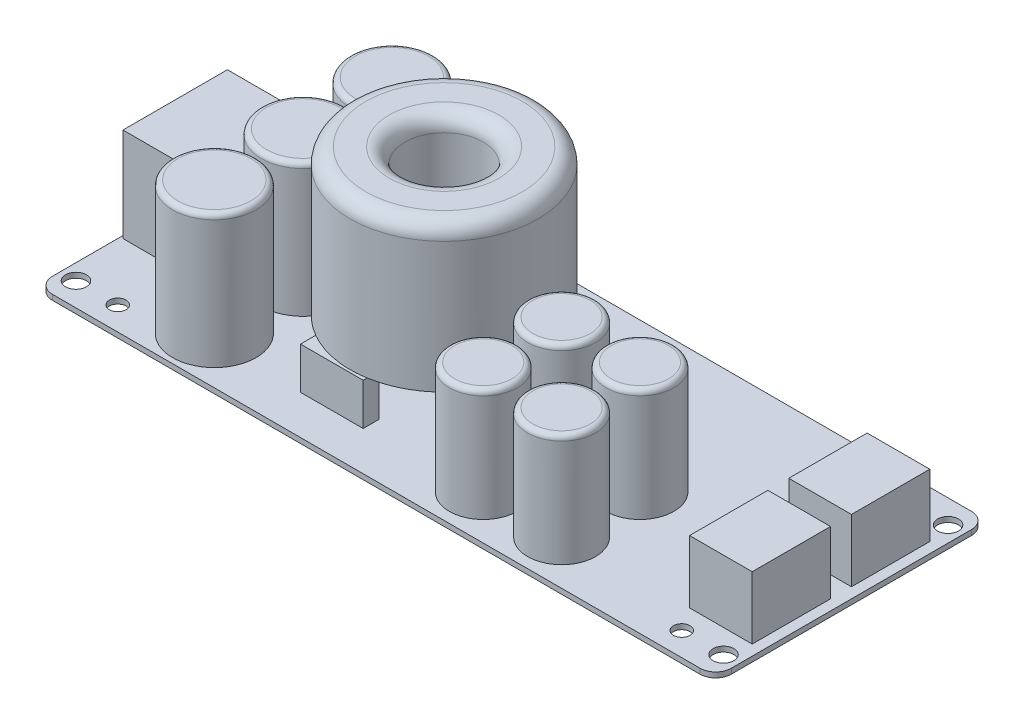
from build123d import *

# Parameters (mm, degrees)
BOSS_EXTRUDE1_DEPTH = 1
CUT_EXTRUDE1_REACH  = 72.014
SKETCH2_R           = 2
SKETCH2_R_2         = 1.6
SKETCH3_R           = 8
BOSS_EXTRUDE2_DEPTH = 25.5
SKETCH4_R           = 6.5
BOSS_EXTRUDE3_DEPTH = 21.5
SKETCH5_W           = 12
SKETCH5_H           = 3
BOSS_EXTRUDE4_DEPTH = 8
SKETCH6_R           = 18
BOSS_EXTRUDE5_DEPTH = 28
CUT_EXTRUDE2_REACH  = 81.183
SKETCH7_R           = 7.5
SKETCH8_W           = 16
SKETCH8_H           = 20
BOSS_EXTRUDE6_DEPTH = 18
SKETCH9_W           = 12
SKETCH9_H           = 15
BOSS_EXTRUDE7_DEPTH = 12
FILLET1_R           = 3
FILLET2_R           = 1


with BuildPart() as part:
    # Sketch1 → Boss-Extrude1 (new body)
    with BuildSketch(Plane(origin=(0, 0, 0), x_dir=(1, 0, 0), z_dir=(0, 1, 0))):
        with BuildLine():
            Line((-62, 26), (62, 26))
            ThreePointArc((62, 26), (64.121320344, 25.121320344), (65, 23))
            Line((65, 23), (65, -23))
            ThreePointArc((65, -23), (64.121320344, -25.121320344), (62, -26))
            Line((62, -26), (-62, -26))
            ThreePointArc((-62, -26), (-64.121320344, -25.121320344), (-65, -23))
            Line((-65, -23), (-65, 23))
            ThreePointArc((-65, 23), (-64.121320344, 25.121320344), (-62, 26))
        make_face()
    extrude(amount=BOSS_EXTRUDE1_DEPTH)

    # Sketch2 → Cut-Extrude1 (cut, up to next)
    with BuildSketch(Plane(origin=(0, 1, 0), x_dir=(1, 0, 0), z_dir=(0, 1, 0)), mode=Mode.PRIVATE) as cut_extrude1_sk1:
        with Locations(Location((-62, 21.5, 0), (0, 0, 270))):
            Circle(SKETCH2_R)
    cut_extrude1_tool1 = extrude(cut_extrude1_sk1.sketch, amount=-CUT_EXTRUDE1_REACH, mode=Mode.PRIVATE) & part.part
    # Sketch2 → Cut-Extrude1 (cut, up to next)
    with BuildSketch(Plane(origin=(0, 1, 0), x_dir=(1, 0, 0), z_dir=(0, 1, 0)), mode=Mode.PRIVATE) as cut_extrude1_sk2:
        with Locations(Location((-62, -21.5, 0), (0, 0, 270))):
            Circle(SKETCH2_R)
    cut_extrude1_tool2 = extrude(cut_extrude1_sk2.sketch, amount=-CUT_EXTRUDE1_REACH, mode=Mode.PRIVATE) & part.part
    # Sketch2 → Cut-Extrude1 (cut, up to next)
    with BuildSketch(Plane(origin=(0, 1, 0), x_dir=(1, 0, 0), z_dir=(0, 1, 0)), mode=Mode.PRIVATE) as cut_extrude1_sk3:
        with Locations(Location((62, -21.5, 0), (0, 0, 270))):
            Circle(SKETCH2_R)
    cut_extrude1_tool3 = extrude(cut_extrude1_sk3.sketch, amount=-CUT_EXTRUDE1_REACH, mode=Mode.PRIVATE) & part.part
    # Sketch2 → Cut-Extrude1 (cut, up to next)
    with BuildSketch(Plane(origin=(0, 1, 0), x_dir=(1, 0, 0), z_dir=(0, 1, 0)), mode=Mode.PRIVATE) as cut_extrude1_sk4:
        with Locations(Location((62, 21.5, 0), (0, 0, 270))):
            Circle(SKETCH2_R)
    cut_extrude1_tool4 = extrude(cut_extrude1_sk4.sketch, amount=-CUT_EXTRUDE1_REACH, mode=Mode.PRIVATE) & part.part
    # Sketch2 → Cut-Extrude1 (cut, up to next)
    with BuildSketch(Plane(origin=(0, 1, 0), x_dir=(1, 0, 0), z_dir=(0, 1, 0)), mode=Mode.PRIVATE) as cut_extrude1_sk5:
        with Locations(Location((-54, -21.5, 0), (0, 0, 270))):
            Circle(SKETCH2_R_2)
    cut_extrude1_tool5 = extrude(cut_extrude1_sk5.sketch, amount=-CUT_EXTRUDE1_REACH, mode=Mode.PRIVATE) & part.part
    # Sketch2 → Cut-Extrude1 (cut, up to next)
    with BuildSketch(Plane(origin=(0, 1, 0), x_dir=(1, 0, 0), z_dir=(0, 1, 0)), mode=Mode.PRIVATE) as cut_extrude1_sk6:
        with Locations(Location((-54, 21.5, 0), (0, 0, 270))):
            Circle(SKETCH2_R_2)
    cut_extrude1_tool6 = extrude(cut_extrude1_sk6.sketch, amount=-CUT_EXTRUDE1_REACH, mode=Mode.PRIVATE) & part.part
    # Sketch2 → Cut-Extrude1 (cut, up to next)
    with BuildSketch(Plane(origin=(0, 1, 0), x_dir=(1, 0, 0), z_dir=(0, 1, 0)), mode=Mode.PRIVATE) as cut_extrude1_sk7:
        with Locations(Location((54, 21.5, 0), (0, 0, 270))):
            Circle(SKETCH2_R_2)
    cut_extrude1_tool7 = extrude(cut_extrude1_sk7.sketch, amount=-CUT_EXTRUDE1_REACH, mode=Mode.PRIVATE) & part.part
    # Sketch2 → Cut-Extrude1 (cut, up to next)
    with BuildSketch(Plane(origin=(0, 1, 0), x_dir=(1, 0, 0), z_dir=(0, 1, 0)), mode=Mode.PRIVATE) as cut_extrude1_sk8:
        with Locations(Location((54, -21.5, 0), (0, 0, 270))):
            Circle(SKETCH2_R_2)
    cut_extrude1_tool8 = extrude(cut_extrude1_sk8.sketch, amount=-CUT_EXTRUDE1_REACH, mode=Mode.PRIVATE) & part.part
    add(cut_extrude1_tool1.solids().sort_by_distance((-62, 1, -21.5))[0], mode=Mode.SUBTRACT)
    add(cut_extrude1_tool2.solids().sort_by_distance((-62, 1, 21.5))[0], mode=Mode.SUBTRACT)
    add(cut_extrude1_tool3.solids().sort_by_distance((62, 1, 21.5))[0], mode=Mode.SUBTRACT)
    add(cut_extrude1_tool4.solids().sort_by_distance((62, 1, -21.5))[0], mode=Mode.SUBTRACT)
    add(cut_extrude1_tool5.solids().sort_by_distance((-54, 1, 21.5))[0], mode=Mode.SUBTRACT)
    add(cut_extrude1_tool6.solids().sort_by_distance((-54, 1, -21.5))[0], mode=Mode.SUBTRACT)
    add(cut_extrude1_tool7.solids().sort_by_distance((54, 1, -21.5))[0], mode=Mode.SUBTRACT)
    add(cut_extrude1_tool8.solids().sort_by_distance((54, 1, 21.5))[0], mode=Mode.SUBTRACT)

    # Sketch3 → Boss-Extrude2 (add)
    with BuildSketch(Plane(origin=(0, 1, 0), x_dir=(1, 0, 0), z_dir=(0, 1, 0))):
        with Locations(Location((-40, 17, 0), (0, 0, 90))):
            Circle(SKETCH3_R)
        with Locations(Location((-40, 0, 0), (0, 0, 90))):
            Circle(SKETCH3_R)
        with Locations(Location((-40, -17, 0), (0, 0, 90))):
            Circle(SKETCH3_R)
    extrude(amount=BOSS_EXTRUDE2_DEPTH)

    # Sketch4 → Boss-Extrude3 (add)
    with BuildSketch(Plane(origin=(0, 1, 0), x_dir=(1, 0, 0), z_dir=(0, 1, 0))):
        with Locations(Location((12, -17.5, 0), (0, 0, 90))):
            Circle(SKETCH4_R)
        with Locations(Location((12, -2.5, 0), (0, 0, 90))):
            Circle(SKETCH4_R)
        with Locations(Location((27, -2.5, 0), (0, 0, 90))):
            Circle(SKETCH4_R)
        with Locations(Location((27, -17.5, 0), (0, 0, 90))):
            Circle(SKETCH4_R)
    extrude(amount=BOSS_EXTRUDE3_DEPTH)

    # Sketch5 → Boss-Extrude4 (add)
    with BuildSketch(Plane(origin=(0, 1, 0), x_dir=(1, 0, 0), z_dir=(0, 1, 0))):
        with Locations((-16, -17)):
            Rectangle(SKETCH5_W, SKETCH5_H)
    extrude(amount=BOSS_EXTRUDE4_DEPTH)

    # Sketch6 → Boss-Extrude5 (add)
    with BuildSketch(Plane(origin=(0, 9, 0), x_dir=(1, 0, 0), z_dir=(0, 1, 0))):
        with Locations(Location((-13, 0, 0), (0, 0, 240))):
            Circle(SKETCH6_R)
    extrude(amount=BOSS_EXTRUDE5_DEPTH)

    # Sketch7 → Cut-Extrude2 (cut, up to next)
    with BuildSketch(Plane(origin=(0, 37, 0), x_dir=(1, 0, 0), z_dir=(0, 1, 0)), mode=Mode.PRIVATE) as cut_extrude2_sk1:
        with Locations(Location((-13, 0, 0), (0, 0, 270))):
            Circle(SKETCH7_R)
    cut_extrude2_tool1 = extrude(cut_extrude2_sk1.sketch, amount=-CUT_EXTRUDE2_REACH, mode=Mode.PRIVATE) & part.part
    add(cut_extrude2_tool1.solids().sort_by_distance((-13, 37, 0))[0], mode=Mode.SUBTRACT)

    # Sketch8 → Boss-Extrude6 (add)
    with BuildSketch(Plane(origin=(0, 1, 0), x_dir=(1, 0, 0), z_dir=(0, 1, 0))):
        with Locations((-56.5, 0)):
            Rectangle(SKETCH8_W, SKETCH8_H)
    extrude(amount=BOSS_EXTRUDE6_DEPTH)

    # Sketch9 → Boss-Extrude7 (add)
    with BuildSketch(Plane(origin=(0, 1, 0), x_dir=(1, 0, 0), z_dir=(0, 1, 0))):
        with Locations((57, -9.5)):
            Rectangle(SKETCH9_W, SKETCH9_H)
        with Locations((57, 9.5)):
            Rectangle(SKETCH9_W, SKETCH9_H)
    extrude(amount=BOSS_EXTRUDE7_DEPTH)

    # Fillet1
    fillet1_edges = [part.edges().sort_by_distance(p)[0] for p in [
        (-4, 37, -15.588457268),
        (-13, 9, -7.5),
        (-13, 37, -7.5),
    ]]
    fillet(fillet1_edges, radius=FILLET1_R)

    # Fillet2
    fillet2_edges = [part.edges().sort_by_distance(p)[0] for p in [
        (-40, 26.5, -9),
        (-40, 26.5, 8),
        (-40, 26.5, 25),
        (12, 22.5, 24),
        (12, 22.5, 9),
        (27, 22.5, 9),
        (27, 22.5, 24),
    ]]
    fillet(fillet2_edges, radius=FILLET2_R)


solid = part.part
